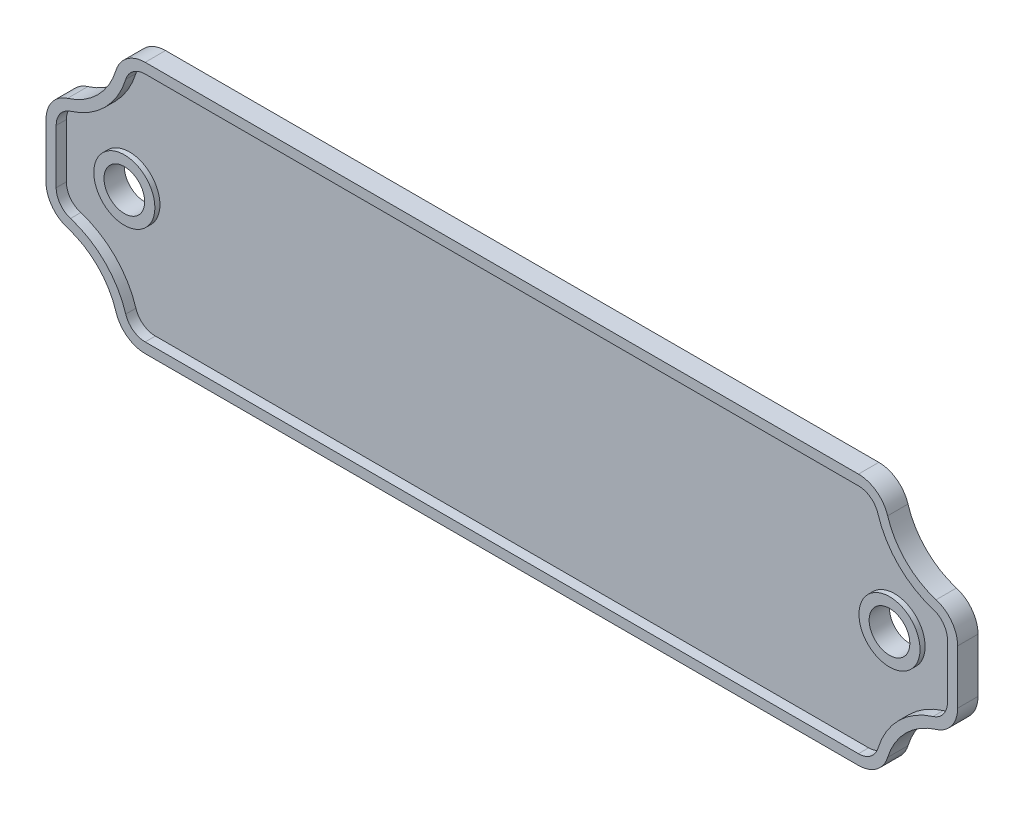
from build123d import *

# Parameters (mm, degrees)
BOSS_EXTRUDE1_DEPTH      = 2.5
SKETCH1_3_R              = 3.75
BOSS_EXTRUDE2_DEPTH      = 1.25
BOSS_EXTRUDE4_DEPTH      = 1.875
BOSS_EXTRUDE4_DEPTH_BACK = 0.625
SKETCH1_4_R              = 3.75
SKETCH1_4_R_2            = 2.5


with BuildPart() as part:
    # Sketch1 → Boss-Extrude1 (new body)
    with BuildSketch(Plane.XY):
        with BuildLine():
            ThreePointArc((-53.352941176, 6.898076983), (-55.26649875, 5.541774365), (-56, 3.313942393))
            Line((-56, 3.313942393), (-56, -3.313942393))
            ThreePointArc((-56, -3.313942393), (-55.26649875, -5.541774365), (-53.352941176, -6.898076983))
            ThreePointArc((-53.352941176, -6.898076983), (-49.636038969, -9.136038969), (-47.398076983, -12.852941176))
            ThreePointArc((-47.398076983, -12.852941176), (-46.041774365, -14.76649875), (-43.813942393, -15.5))
            Line((-43.813942393, -15.5), (0, -15.5))
            Line((0, -15.5), (43.813942393, -15.5))
            ThreePointArc((43.813942393, -15.5), (46.041774365, -14.76649875), (47.398076983, -12.852941176))
            ThreePointArc((47.398076983, -12.852941176), (49.636038969, -9.136038969), (53.352941176, -6.898076983))
            ThreePointArc((53.352941176, -6.898076983), (55.26649875, -5.541774365), (56, -3.313942393))
            Line((56, -3.313942393), (56, 3.313942393))
            ThreePointArc((56, 3.313942393), (55.26649875, 5.541774365), (53.352941176, 6.898076983))
            ThreePointArc((53.352941176, 6.898076983), (49.636038969, 9.136038969), (47.398076983, 12.852941176))
            ThreePointArc((47.398076983, 12.852941176), (46.041774365, 14.76649875), (43.813942393, 15.5))
            Line((43.813942393, 15.5), (0, 15.5))
            Line((0, 15.5), (-43.813942393, 15.5))
            ThreePointArc((-43.813942393, 15.5), (-46.041774365, 14.76649875), (-47.398076983, 12.852941176))
            ThreePointArc((-47.398076983, 12.852941176), (-49.636038969, 9.136038969), (-53.352941176, 6.898076983))
        make_face()
        with BuildLine():
            Line((43.813942393, -14.25), (0, -14.25))
            Line((0, -14.25), (-43.813942393, -14.25))
            ThreePointArc((-43.813942393, -14.25), (-45.299163708, -13.760999166), (-46.203365453, -12.485294118))
            ThreePointArc((-46.203365453, -12.485294118), (-48.752155493, -8.252155493), (-52.985294118, -5.703365453))
            ThreePointArc((-52.985294118, -5.703365453), (-54.260999166, -4.799163708), (-54.75, -3.313942393))
            Line((-54.75, -3.313942393), (-54.75, 3.313942393))
            ThreePointArc((-54.75, 3.313942393), (-54.260999166, 4.799163708), (-52.985294118, 5.703365453))
            ThreePointArc((-52.985294118, 5.703365453), (-48.752155493, 8.252155493), (-46.203365453, 12.485294118))
            ThreePointArc((-46.203365453, 12.485294118), (-45.299163708, 13.760999166), (-43.813942393, 14.25))
            Line((-43.813942393, 14.25), (0, 14.25))
            Line((0, 14.25), (43.813942393, 14.25))
            ThreePointArc((43.813942393, 14.25), (45.299163708, 13.760999166), (46.203365453, 12.485294118))
            ThreePointArc((46.203365453, 12.485294118), (48.752155493, 8.252155493), (52.985294118, 5.703365453))
            ThreePointArc((52.985294118, 5.703365453), (54.260999166, 4.799163708), (54.75, 3.313942393))
            Line((54.75, 3.313942393), (54.75, -3.313942393))
            ThreePointArc((54.75, -3.313942393), (54.260999166, -4.799163708), (52.985294118, -5.703365453))
            ThreePointArc((52.985294118, -5.703365453), (48.752155493, -8.252155493), (46.203365453, -12.485294118))
            ThreePointArc((46.203365453, -12.485294118), (45.299163708, -13.760999166), (43.813942393, -14.25))
        make_face(mode=Mode.SUBTRACT)
    extrude(amount=BOSS_EXTRUDE1_DEPTH)

    # Sketch1<3> → Boss-Extrude2 (add)
    with BuildSketch(Plane.XY):
        with BuildLine():
            Line((-43.813942393, -14.25), (0, -14.25))
            Line((0, -14.25), (43.813942393, -14.25))
            ThreePointArc((43.813942393, -14.25), (45.299163708, -13.760999166), (46.203365453, -12.485294118))
            ThreePointArc((46.203365453, -12.485294118), (48.752155493, -8.252155493), (52.985294118, -5.703365453))
            ThreePointArc((52.985294118, -5.703365453), (54.260999166, -4.799163708), (54.75, -3.313942393))
            Line((54.75, -3.313942393), (54.75, 3.313942393))
            ThreePointArc((54.75, 3.313942393), (54.260999166, 4.799163708), (52.985294118, 5.703365453))
            ThreePointArc((52.985294118, 5.703365453), (48.752155493, 8.252155493), (46.203365453, 12.485294118))
            ThreePointArc((46.203365453, 12.485294118), (45.299163708, 13.760999166), (43.813942393, 14.25))
            Line((43.813942393, 14.25), (0, 14.25))
            Line((0, 14.25), (-43.813942393, 14.25))
            ThreePointArc((-43.813942393, 14.25), (-45.299163708, 13.760999166), (-46.203365453, 12.485294118))
            ThreePointArc((-46.203365453, 12.485294118), (-48.752155493, 8.252155493), (-52.985294118, 5.703365453))
            ThreePointArc((-52.985294118, 5.703365453), (-54.260999166, 4.799163708), (-54.75, 3.313942393))
            Line((-54.75, 3.313942393), (-54.75, -3.313942393))
            ThreePointArc((-54.75, -3.313942393), (-54.260999166, -4.799163708), (-52.985294118, -5.703365453))
            ThreePointArc((-52.985294118, -5.703365453), (-48.752155493, -8.252155493), (-46.203365453, -12.485294118))
            ThreePointArc((-46.203365453, -12.485294118), (-45.299163708, -13.760999166), (-43.813942393, -14.25))
        make_face()
        with Locations((-47, 0)):
            Circle(SKETCH1_3_R, mode=Mode.SUBTRACT)
        with Locations((47, 0)):
            Circle(SKETCH1_3_R, mode=Mode.SUBTRACT)
    extrude(amount=BOSS_EXTRUDE2_DEPTH)

    # Sketch1<4> → Boss-Extrude4 (add, two sides: drawn at the far end of the back side and taken through both)
    # profile 1 of 2: a face of its own
    with BuildSketch(Plane.XY.offset(-BOSS_EXTRUDE4_DEPTH_BACK)):
        with Locations((-47, 0)):
            Circle(SKETCH1_4_R)
        with Locations((-47, 0)):
            Circle(SKETCH1_4_R_2, mode=Mode.SUBTRACT)
    # profile 2 of 2: a face of its own
    with BuildSketch(Plane.XY.offset(-BOSS_EXTRUDE4_DEPTH_BACK)):
        with Locations((47, 0)):
            Circle(SKETCH1_4_R)
        with Locations((47, 0)):
            Circle(SKETCH1_4_R_2, mode=Mode.SUBTRACT)
    extrude(amount=BOSS_EXTRUDE4_DEPTH + BOSS_EXTRUDE4_DEPTH_BACK)


solid = part.part
